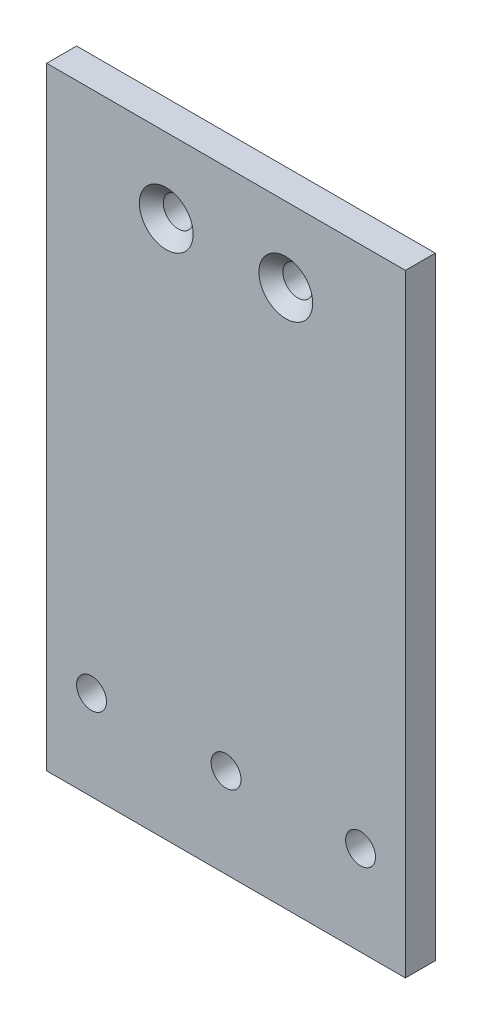
from build123d import *

# Parameters (mm, degrees)
SKETCH1_W           = 76.2
SKETCH1_H           = 139.7
BOSS_EXTRUDE1_DEPTH = 6.35
SKETCH2_R           = 3.175
CUT_EXTRUDE1_DEPTH  = 6.35
CHAMFER2_SIZE       = 2.54
SKETCH3_W           = 6.35
SKETCH3_H           = 9.525
CUT_EXTRUDE2_DEPTH  = 104.565365832


with BuildPart() as part:
    # Sketch1 → Boss-Extrude1 (new body)
    with BuildSketch(Plane.XY):
        Rectangle(SKETCH1_W, SKETCH1_H)
    extrude(amount=BOSS_EXTRUDE1_DEPTH)

    # Sketch2 → Cut-Extrude1 (cut)
    with BuildSketch(Plane.XY.offset(6.35)):
        with Locations((-12.7, 44.45)):
            Circle(SKETCH2_R)
        with Locations((12.7, 44.45)):
            Circle(SKETCH2_R)
        with Locations((-28.575, -50.8)):
            Circle(SKETCH2_R)
        with Locations((0, -50.8)):
            Circle(SKETCH2_R)
        with Locations((28.575, -50.8)):
            Circle(SKETCH2_R)
    extrude(amount=-CUT_EXTRUDE1_DEPTH, mode=Mode.SUBTRACT)

    # Chamfer2
    chamfer2_edges = [part.edges().sort_by_distance(p)[0] for p in [
        (-15.875, 44.45, 6.35),
        (9.525, 44.45, 6.35),
    ]]
    chamfer(chamfer2_edges, length=CHAMFER2_SIZE)

    # Sketch3 → Cut-Extrude2 (cut, through all)
    with BuildSketch(Plane.ZY.offset(38.1)):
        with Locations((3.175, 65.0875)):
            Rectangle(SKETCH3_W, SKETCH3_H)
    extrude(amount=-CUT_EXTRUDE2_DEPTH, mode=Mode.SUBTRACT)


solid = part.part
